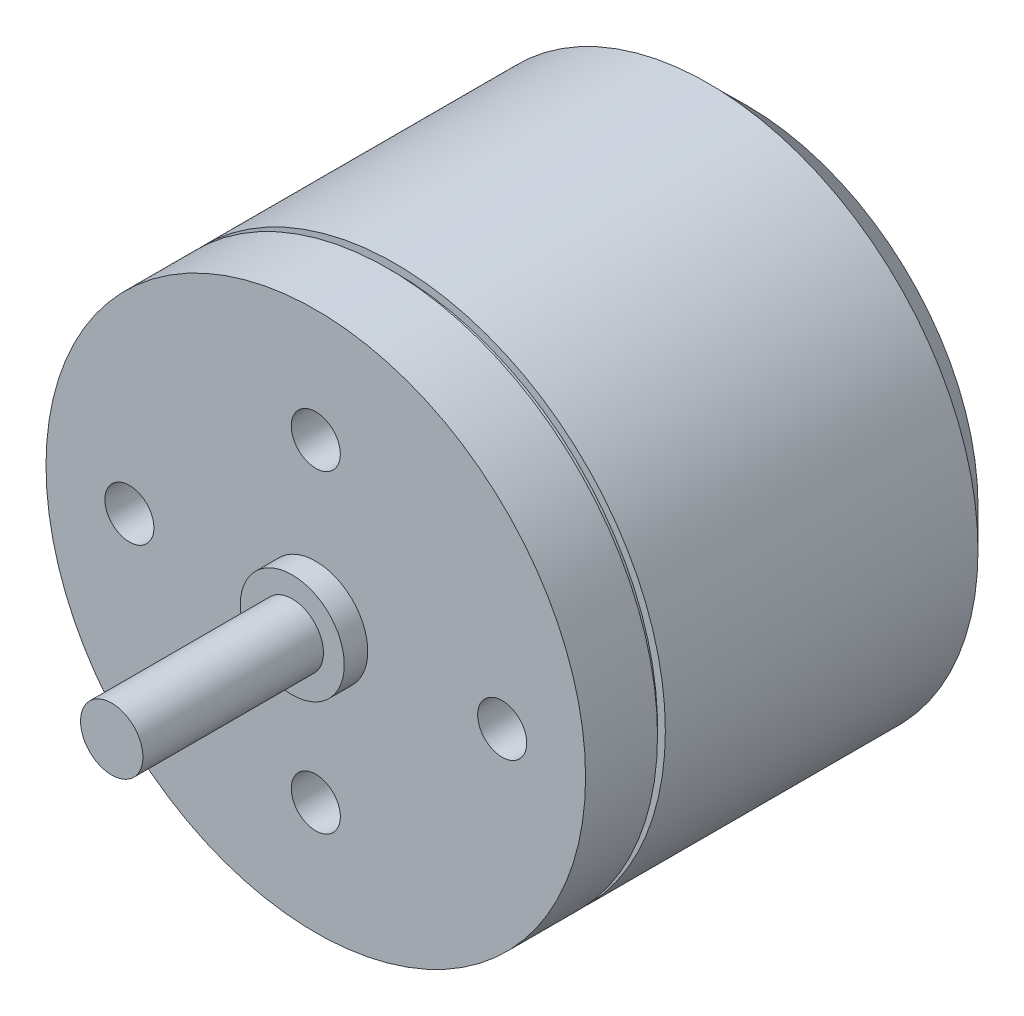
from build123d import *

# Parameters (mm, degrees)
SKETCH2_R           = 1.25
CUT_EXTRUDE1_DEPTH  = 2
SKETCH3_R           = 1.25
CUT_EXTRUDE2_DEPTH  = 2
SKETCH4_R           = 2.65
BOSS_EXTRUDE1_DEPTH = 1.2
SKETCH5_R           = 1.59
BOSS_EXTRUDE2_DEPTH = 9.2
CHAMFER1_SIZE       = 2


with BuildPart() as part:
    # Sketch1 → Revolve1 (revolve)
    with BuildSketch(Plane(origin=(0, 0, 0), x_dir=(1, 0, 0), z_dir=(0, 1, 0)), mode=Mode.PRIVATE) as revolve1_sk:
        Polygon((13.75, 0), (13.75, 3.666666667), (13.35, 3.666666667), (13.35, 4.066666667), (13.75, 4.066666667), (13.75, 22), (0, 22), (0, 0), align=None)
    revolve(revolve1_sk.sketch.rotate(Axis((0, 0, -22), (0, 0, 1)), 180), axis=Axis((0, 0, -22), (0, 0, 1)))

    # Sketch2 → Cut-Extrude1 (cut)
    with BuildSketch(Plane.XY):
        with Locations((9.5, 0)):
            Circle(SKETCH2_R)
        with Locations((0, 8)):
            Circle(SKETCH2_R)
        with Locations(Location((0, -8, 0), (0, 0, 180))):
            Circle(SKETCH2_R)
        with Locations(Location((-9.5, 0, 0), (0, 0, 180))):
            Circle(SKETCH2_R)
    extrude(amount=-CUT_EXTRUDE1_DEPTH, mode=Mode.SUBTRACT)

    # Sketch3 → Cut-Extrude2 (cut)
    with BuildSketch(Plane(origin=(0, 0, -22), x_dir=(-1, 0, 0), z_dir=(0, 0, -1))):
        with Locations((6, 0)):
            Circle(SKETCH3_R)
        with Locations((0, -6)):
            Circle(SKETCH3_R)
        with Locations((-6, 0)):
            Circle(SKETCH3_R)
        with Locations((0, 6)):
            Circle(SKETCH3_R)
    extrude(amount=-CUT_EXTRUDE2_DEPTH, mode=Mode.SUBTRACT)

    # Sketch4 → Boss-Extrude1 (add)
    with BuildSketch(Plane.XY):
        with Locations(Location((0, 0, 0), (0, 0, 180))):
            Circle(SKETCH4_R)
    extrude(amount=BOSS_EXTRUDE1_DEPTH)

    # Sketch5 → Boss-Extrude2 (add)
    with BuildSketch(Plane.XY.offset(1.2)):
        Circle(SKETCH5_R)
    extrude(amount=BOSS_EXTRUDE2_DEPTH)

    # Chamfer1
    chamfer1_edges = [part.edges().sort_by_distance(p)[0] for p in [
        (13.75, 0, -22),
    ]]
    chamfer(chamfer1_edges, length=CHAMFER1_SIZE)


solid = part.part
